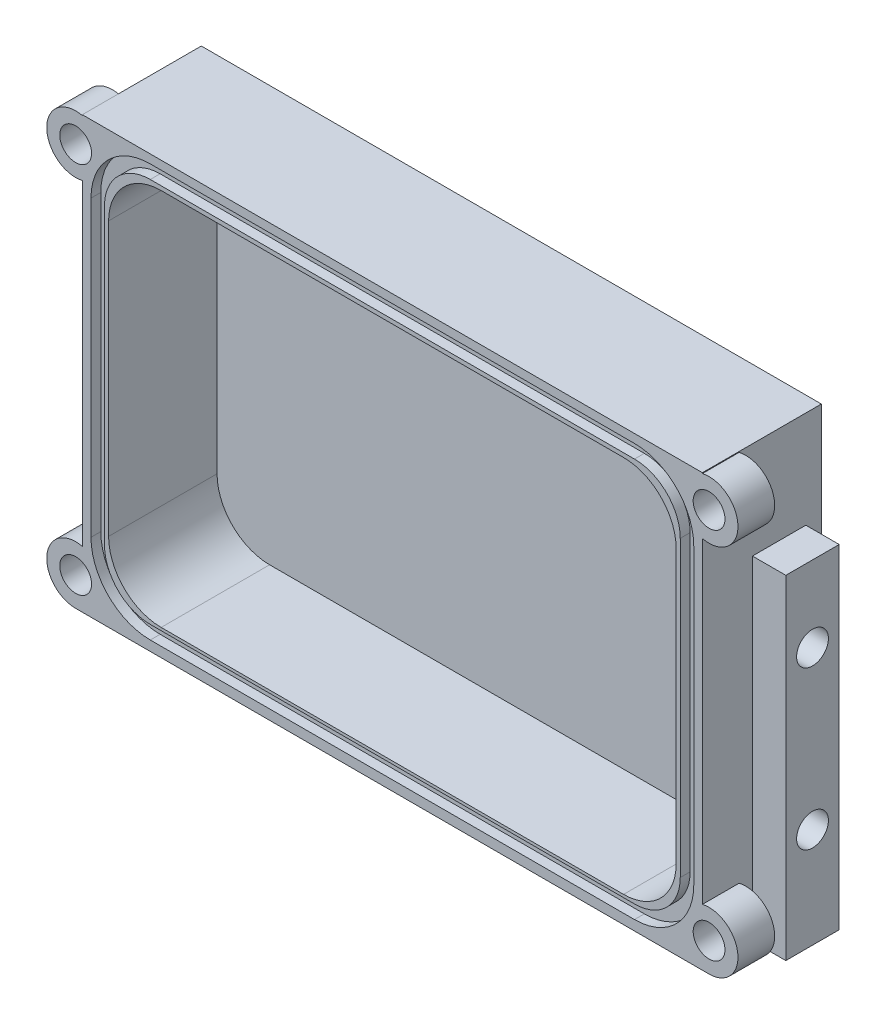
from build123d import *
from build123d.topology import SkipClean

# Parameters (mm, degrees)
SKETCH2_W           = 108
SKETCH2_H           = 72
BOSS_EXTRUDE1_DEPTH = 20.64
SHELL1_T            = 5
SKETCH3_W           = 118
SKETCH3_H           = 82
CUT_EXTRUDE1_DEPTH  = 3
FILLET1_R           = 10
BOSS_EXTRUDE2_DEPTH = 6.985
SKETCH6_4_R         = 3.025
CUT_EXTRUDE4_DEPTH  = 6.35
CUT_EXTRUDE2_DEPTH  = 1.875
SKETCH14_W          = 10.16
SKETCH14_H          = 63.5
SKETCH14_R          = 3.02514
BOSS_EXTRUDE5_DEPTH = 6.35


with BuildPart() as part:
    # Sketch2 → Boss-Extrude1 (new body)
    with BuildSketch(Plane.XY):
        Rectangle(SKETCH2_W, SKETCH2_H)
    extrude(amount=BOSS_EXTRUDE1_DEPTH)

    # Shell1
    shell1_openings = [part.faces().sort_by_distance(p)[0] for p in [
        (0, 0, 20.64),
    ]]
    offset(amount=SHELL1_T, openings=shell1_openings, kind=Kind.INTERSECTION)

    # Sketch3 → Cut-Extrude1 (cut)
    with BuildSketch(Plane(origin=(0, 0, -5), x_dir=(-1, 0, 0), z_dir=(0, 0, -1))):
        Rectangle(SKETCH3_W, SKETCH3_H)
    extrude(amount=-CUT_EXTRUDE1_DEPTH, mode=Mode.SUBTRACT)

    # Fillet1
    fillet1_edges = [part.edges().sort_by_distance(p)[0] for p in [
        (54, -36, 10.32),
        (-54, -36, 10.32),
        (54, 36, 10.32),
        (-54, 36, 10.32),
    ]]
    fillet(fillet1_edges, radius=FILLET1_R)

    # Sketch6 → Boss-Extrude2 (add)
    with BuildSketch(Plane.XY.offset(20.64)):
        with BuildLine():
            ThreePointArc((59, 30.148635688), (65.77, 35.5), (59, 40.851364312))
            Line((59, 40.851364312), (59, 30.148635688))
        make_face()
        with BuildLine():
            Line((59, -41), (60.27, -41))
            ThreePointArc((60.27, -41), (65.732714697, -34.86066586), (59, -30.148635688))
            Line((59, -30.148635688), (59, -32.754508241))
            ThreePointArc((59, -32.754508241), (57.245, -35.5), (59, -38.245491759))
            Line((59, -38.245491759), (59, -41))
        make_face()
        with BuildLine():
            ThreePointArc((-59, -38.245491759), (-57.245, -35.5), (-59, -32.754508241))
            Line((-59, -32.754508241), (-59, -30.148635688))
            ThreePointArc((-59, -30.148635688), (-65.77, -35.5), (-59, -40.851364312))
            Line((-59, -40.851364312), (-59, -38.245491759))
        make_face()
        with BuildLine():
            ThreePointArc((-59, 40.851364312), (-65.77, 35.5), (-59, 30.148635688))
            Line((-59, 30.148635688), (-59, 40.851364312))
        make_face()
    boss_extrude2 = extrude(amount=-BOSS_EXTRUDE2_DEPTH)

    # Sketch6<4> → Cut-Extrude4 (cut)
    with BuildSketch(Plane.XY.offset(20.64)):
        with Locations((60.27, -35.5)):
            Circle(SKETCH6_4_R)
        with Locations((60.27, 35.5)):
            Circle(SKETCH6_4_R)
        with Locations((-60.27, -35.5)):
            Circle(SKETCH6_4_R)
        with Locations((-60.27, 35.5)):
            Circle(SKETCH6_4_R)
    cut_extrude4 = extrude(amount=-CUT_EXTRUDE4_DEPTH, mode=Mode.SUBTRACT)

    # Mirror5: Boss-Extrude2, Cut-Extrude4 across plane
    with SkipClean():  # the faces are left unmerged after this step: merging them gives an invalid solid
        add(boss_extrude2.mirror(Plane(origin=(0, 0, 0), x_dir=(0, 0, 1), z_dir=(1, 0, 0))))
        add(cut_extrude4.mirror(Plane(origin=(0, 0, 0), x_dir=(0, 0, 1), z_dir=(1, 0, 0))), mode=Mode.SUBTRACT)
    add(part.part.scale(1), mode=Mode.REPLACE)  # the faces are merged on a copy

    # Sketch5 → Cut-Extrude2 (cut)
    with BuildSketch(Plane.XY.offset(20.64)):
        with BuildLine():
            Line((46.071067812, -39.11), (-46.071067812, -39.11))
            ThreePointArc((-46.071067812, -39.11), (-54.050767838, -35.804700026), (-57.356067812, -27.825))
            Line((-57.356067812, -27.825), (-57.356067812, 28.071067812))
            ThreePointArc((-57.356067812, 28.071067812), (-54.050767838, 36.050767838), (-46.071067812, 39.356067812))
            Line((-46.071067812, 39.356067812), (46.071067812, 39.356067812))
            ThreePointArc((46.071067812, 39.356067812), (54.050767838, 36.050767838), (57.356067812, 28.071067812))
            Line((57.356067812, 28.071067812), (57.356067812, -27.825))
            ThreePointArc((57.356067812, -27.825), (54.050767838, -35.804700026), (46.071067812, -39.11))
        make_face()
        with BuildLine():
            Line((46.071067812, -36.54), (-46.071067812, -36.54))
            ThreePointArc((-46.071067812, -36.54), (-52.23350341, -33.987435598), (-54.786067812, -27.825))
            Line((-54.786067812, -27.825), (-54.786067812, 28.071067812))
            ThreePointArc((-54.786067812, 28.071067812), (-52.23350341, 34.23350341), (-46.071067812, 36.786067812))
            Line((-46.071067812, 36.786067812), (46.071067812, 36.786067812))
            ThreePointArc((46.071067812, 36.786067812), (52.23350341, 34.23350341), (54.786067812, 28.071067812))
            Line((54.786067812, 28.071067812), (54.786067812, -27.825))
            ThreePointArc((54.786067812, -27.825), (52.23350341, -33.987435598), (46.071067812, -36.54))
        make_face(mode=Mode.SUBTRACT)
    extrude(amount=-CUT_EXTRUDE2_DEPTH, mode=Mode.SUBTRACT)

    # Sketch14 → Boss-Extrude5 (add)
    with BuildSketch(Plane(origin=(59, 0, 0), x_dir=(0, 0, -1), z_dir=(1, 0, 0))):
        with Locations((-6.035, -9.25)):
            Rectangle(SKETCH14_W, SKETCH14_H)
        with Locations((-6.035, 8.04994)):
            Circle(SKETCH14_R, mode=Mode.SUBTRACT)
        with Locations((-6.035, -21.95)):
            Circle(SKETCH14_R, mode=Mode.SUBTRACT)
    boss_extrude5 = extrude(amount=BOSS_EXTRUDE5_DEPTH)

    # Mirror6: Boss-Extrude5 across plane
    add(boss_extrude5.mirror(Plane(origin=(0, 0, 0), x_dir=(0, 0, 1), z_dir=(1, 0, 0))))


solid = part.part
